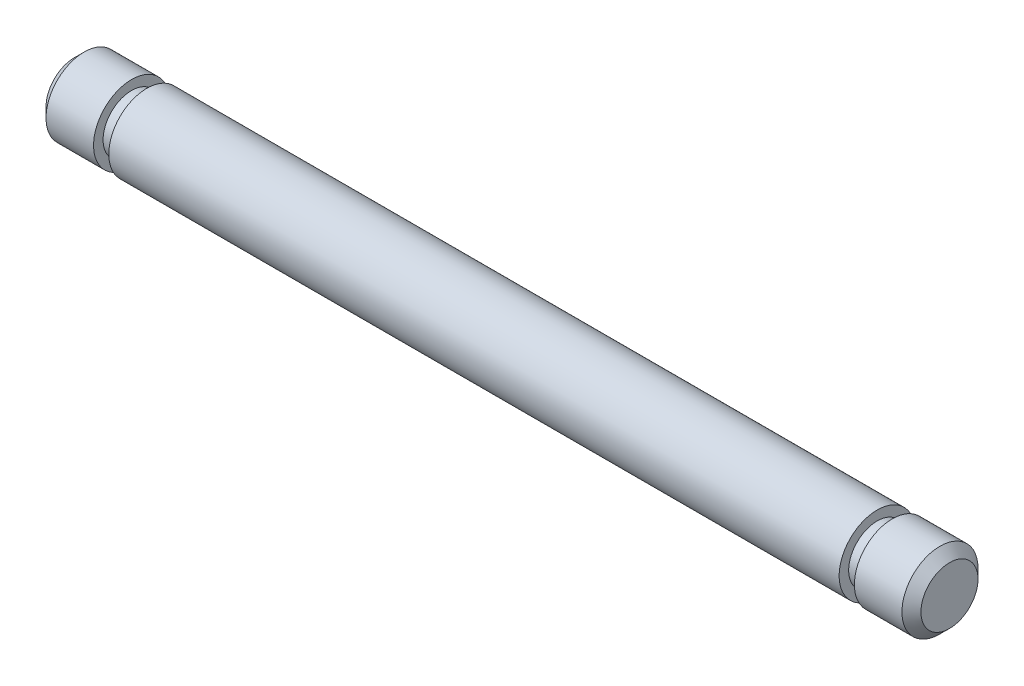
from build123d import *

# Parameters (mm, degrees)
SKETCH1_R           = 2
BOSS_EXTRUDE1_DEPTH = 23
CHAMFER1_SIZE       = 0.5
CUT_EXTRUDE1_START  = -3
SKETCH2_R           = 2
SKETCH2_R_2         = 1.5
CUT_EXTRUDE1_DEPTH  = 0.8


with BuildPart() as part:
    # Sketch1 → Boss-Extrude1 (new, symmetric)
    with BuildSketch(Plane(origin=(0, 0, 0), x_dir=(0, 0, -1), z_dir=(1, 0, 0))):
        Circle(SKETCH1_R)
    extrude(amount=BOSS_EXTRUDE1_DEPTH, both=True)

    # Chamfer1
    chamfer1_edges = [part.edges().sort_by_distance(p)[0] for p in [
        (-23, 0, 2),
        (23, 0, 2),
    ]]
    chamfer(chamfer1_edges, length=CHAMFER1_SIZE)

    # Sketch2 → Cut-Extrude1 (cut)
    with BuildSketch(Plane(origin=(23, 0, 0), x_dir=(0, 0, -1), z_dir=(1, 0, 0)).offset(CUT_EXTRUDE1_START)):
        Circle(SKETCH2_R)
        Circle(SKETCH2_R_2, mode=Mode.SUBTRACT)
    cut_extrude1 = extrude(amount=-CUT_EXTRUDE1_DEPTH, mode=Mode.SUBTRACT)

    # Mirror1: Cut-Extrude1 across plane
    add(cut_extrude1.mirror(Plane(origin=(0, 0, 0), x_dir=(0, 0, 1), z_dir=(1, 0, 0))), mode=Mode.SUBTRACT)


solid = part.part
